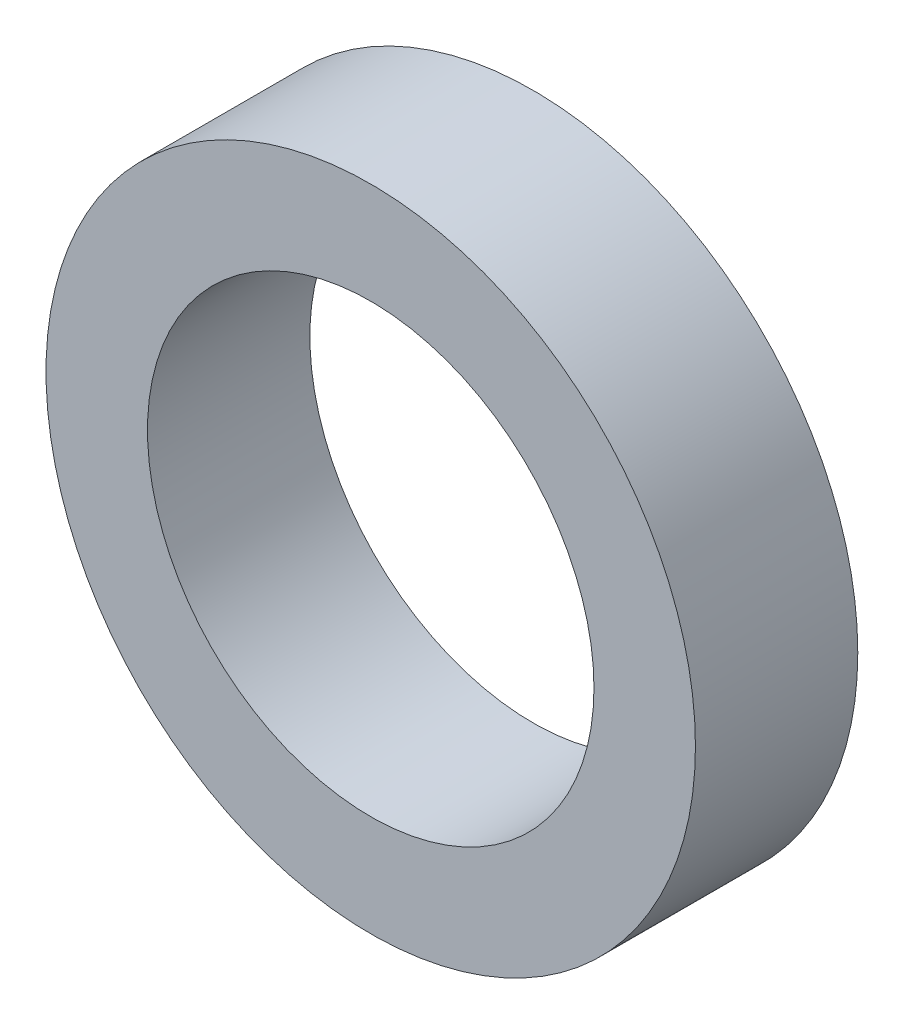
from build123d import *

# Parameters (mm, degrees)
SKETCH_1_R      = 8
SKETCH_1_R_2    = 5.5
EXTRUDE_1_DEPTH = 4


with BuildPart() as part:
    # 草图1 → 凸台-拉伸1 (new body)
    with BuildSketch(Plane.XY):
        Circle(SKETCH_1_R)
        Circle(SKETCH_1_R_2, mode=Mode.SUBTRACT)
    extrude(amount=EXTRUDE_1_DEPTH)


solid = part.part
